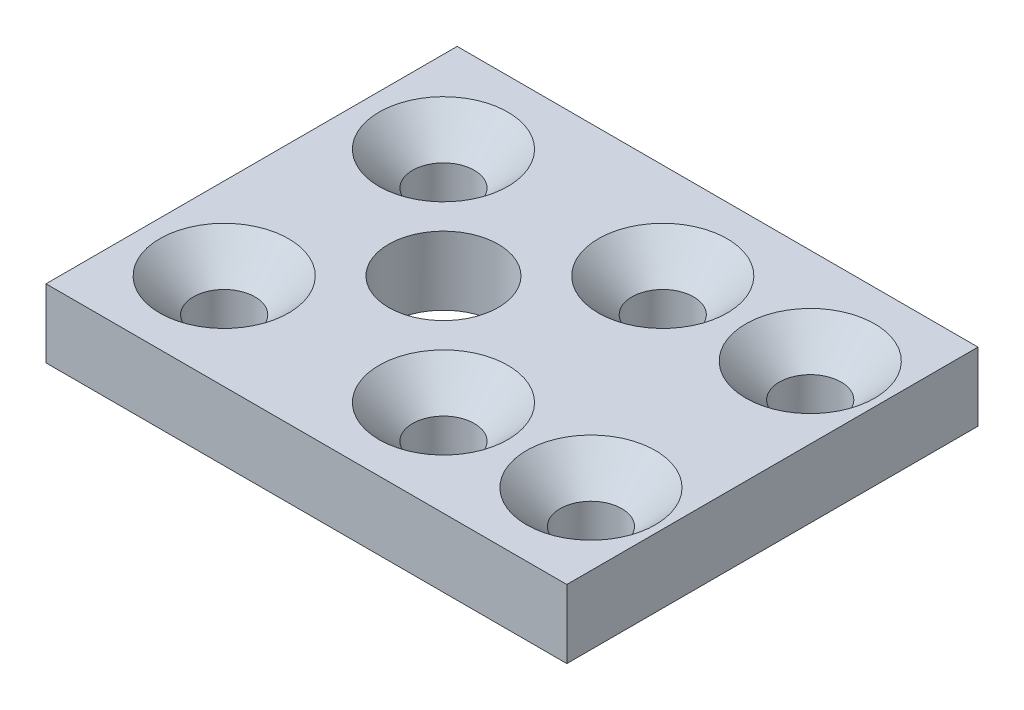
from build123d import *

# Parameters (mm, degrees)
SKIZZE1_W                                            = 38
SKIZZE1_H                                            = 30
AUFSATZ_LINEAR_AUSTRAGEN1_DEPTH                      = 5
FORMSENKUNG_F_R_M4_SENKSCHRAUBE_MIT_SCHL_D           = 4.5
FORMSENKUNG_F_R_M4_SENKSCHRAUBE_MIT_SCHL_CSINK_D     = 9.4
FORMSENKUNG_F_R_M4_SENKSCHRAUBE_MIT_SCHL_CSINK_ANGLE = 90
F_8_0_8_DURCHMESSER_BOHRUNG1_D                       = 8


with BuildPart() as part:
    # Skizze1 → Aufsatz-Linear austragen1 (new body)
    with BuildSketch(Plane(origin=(0, 0, 0), x_dir=(1, 0, 0), z_dir=(0, 1, 0))):
        Rectangle(SKIZZE1_W, SKIZZE1_H)
    extrude(amount=AUFSATZ_LINEAR_AUSTRAGEN1_DEPTH)

    # Formsenkung für M4 Senkschraube mit Schlitz/Kreuzschlitz1 (through all)
    with Locations(Plane(origin=(0, 5, 0), x_dir=(1, 0, 0), z_dir=(0, 1, 0))):
        with Locations((-13, 8), (3, 8), (3, -8), (-13, -8), (13.76, 8), (13.76, -8)):
            CounterSinkHole(FORMSENKUNG_F_R_M4_SENKSCHRAUBE_MIT_SCHL_D / 2, FORMSENKUNG_F_R_M4_SENKSCHRAUBE_MIT_SCHL_CSINK_D / 2, counter_sink_angle=FORMSENKUNG_F_R_M4_SENKSCHRAUBE_MIT_SCHL_CSINK_ANGLE)

    # Ø8.0 (8) Durchmesser Bohrung1 (through all)
    with Locations(Plane(origin=(0, 5, 0), x_dir=(1, 0, 0), z_dir=(0, 1, 0))):
        with Locations((-5, 0)):
            Hole(F_8_0_8_DURCHMESSER_BOHRUNG1_D / 2)


solid = part.part
